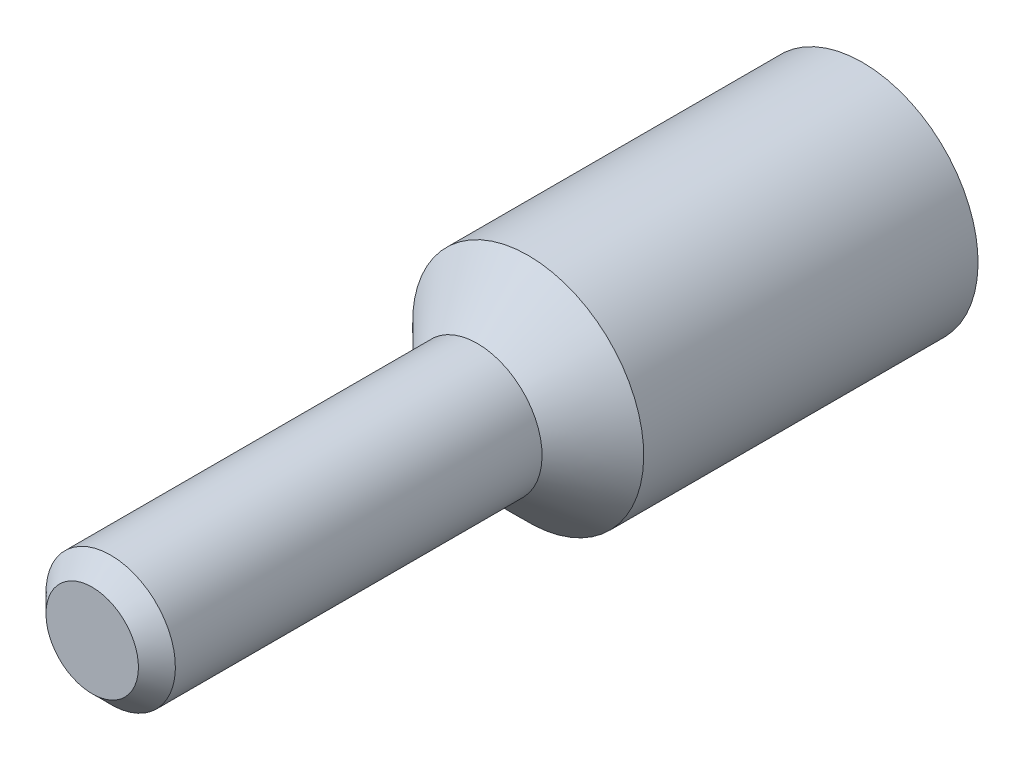
from build123d import *


with BuildPart() as part:
    # Esquisse1 → Révolution1 (revolve)
    with BuildSketch(Plane(origin=(0, 0, 0), x_dir=(0, 0, -1), z_dir=(1, 0, 0))):
        Polygon((36.9, 0), (-13.1, 0), (-13.1, 3), (-11.9, 4.2), (11.9, 4.2), (15.2, 7.5), (36.9, 7.5), align=None)
    revolve(axis=Axis((0, 0, -36.9), (0, 0, 1)))


solid = part.part
